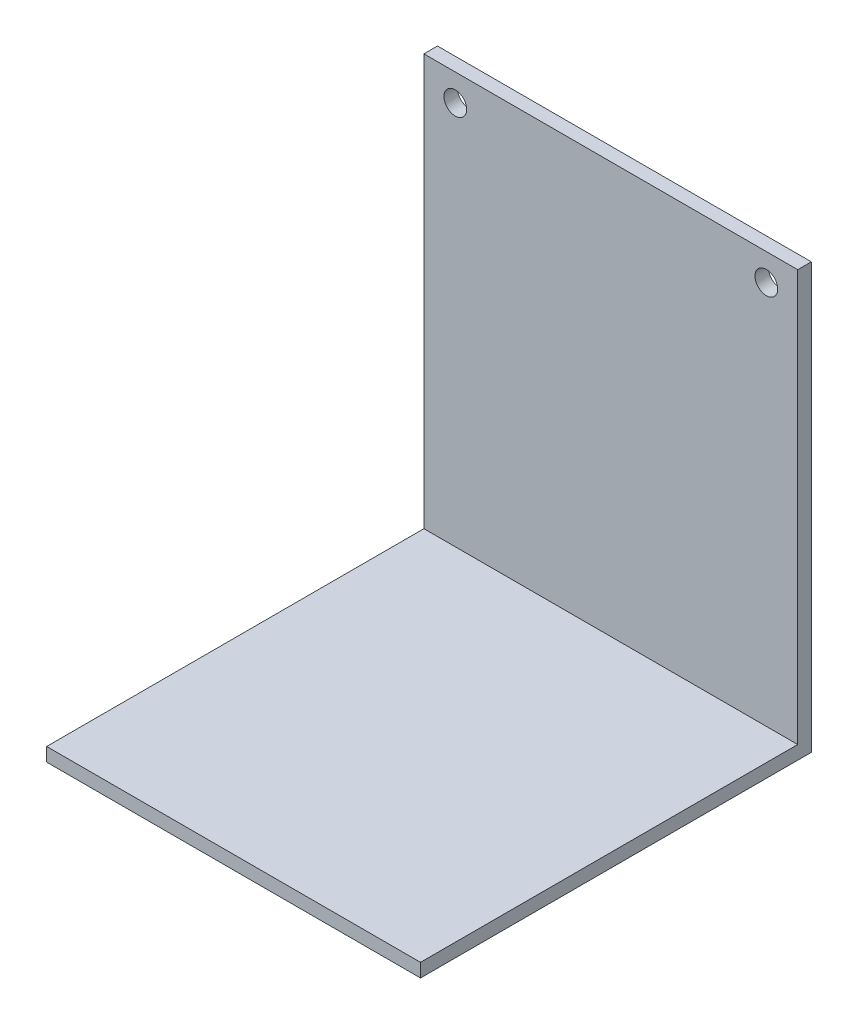
from build123d import *

# Parameters (mm, degrees)
SKETCH1_W           = 69.85
SKETCH1_H           = 79.375
BOSS_EXTRUDE1_DEPTH = 73.025
SKETCH3_W           = 109.285291197
SKETCH3_H           = 81.999714113
CUT_EXTRUDE1_DEPTH  = 132.05389006
SKETCH4_R           = 2.123898891
CUT_EXTRUDE2_DEPTH  = 158.378177563


with BuildPart() as part:
    # Sketch1 → Boss-Extrude1 (new body)
    with BuildSketch(Plane.XY):
        with Locations((-76.752173913, -43.759782609)):
            Rectangle(SKETCH1_W, SKETCH1_H)
    extrude(amount=BOSS_EXTRUDE1_DEPTH)

    # Sketch3 → Cut-Extrude1 (cut, through all)
    with BuildSketch(Plane(origin=(-41.827173913, 0, 0), x_dir=(0, 0, -1), z_dir=(1, 0, 0))):
        with Locations((-57.182645599, -39.907425553)):
            Rectangle(SKETCH3_W, SKETCH3_H)
    extrude(amount=-CUT_EXTRUDE1_DEPTH, mode=Mode.SUBTRACT)

    # Sketch4 → Cut-Extrude2 (cut, through all)
    with BuildSketch(Plane(origin=(0, 0, 0), x_dir=(-1, 0, 0), z_dir=(0, 0, -1))):
        with Locations((47.694573913, -9.09011677)):
            Circle(SKETCH4_R)
        with Locations((105.809773913, -9.09011677)):
            Circle(SKETCH4_R)
    extrude(amount=-CUT_EXTRUDE2_DEPTH, mode=Mode.SUBTRACT)


solid = part.part
